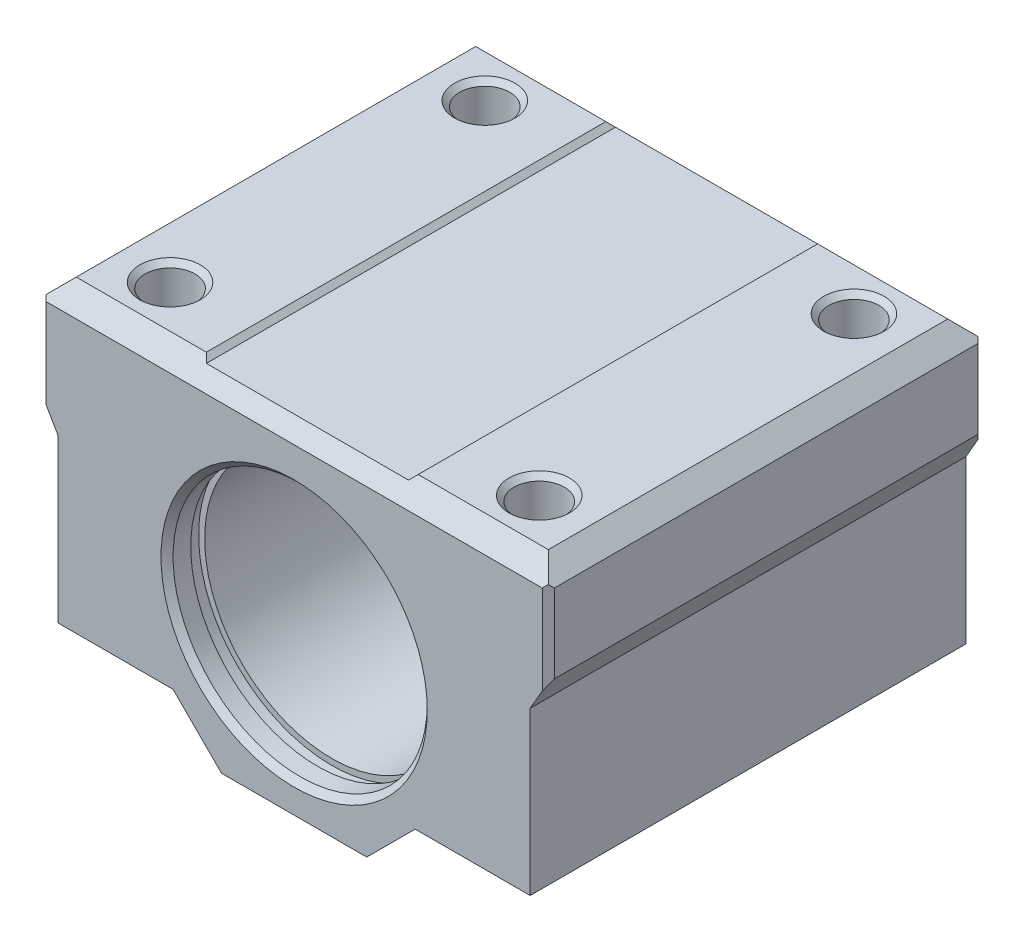
from build123d import *

# Parameters (mm, degrees)
BOSS_EXTRUDE1_DEPTH     = 36
CUT_EXTRUDE1_DEPTH      = 21
CUT_EXTRUDE1_DEPTH_BACK = 21
SKETCH2_W               = 54
SKETCH2_H               = 56
CUT_EXTRUDE2_DEPTH      = 28
CUT_EXTRUDE2_DEPTH_BACK = 28
SKETCH4_W               = 52
SKETCH4_H               = 46


with BuildPart() as part:
    # Sketch1 → Boss-Extrude1 (new body)
    with BuildSketch(Plane.XY):
        Polygon((-21, 13.5), (-21, 7), (-19.5, 4.401923789), (-19.5, -9), (-10, -9), (-6, -13), (6, -13), (10, -9), (19.5, -9), (19.5, 4.401923789), (21, 7), (21, 13.5), (19.5, 15), (8.75, 15), (8.35, 14.6), (-8.35, 14.6), (-8.75, 15), (-19.5, 15), align=None)
    extrude(amount=BOSS_EXTRUDE1_DEPTH)

    # Sketch2 → Cut-Extrude1 (cut, two sides: drawn at the far end of the back side and taken through both)
    with BuildSketch(Plane(origin=(0, 0, 0), x_dir=(0, 0, -1), z_dir=(1, 0, 0)).offset(-CUT_EXTRUDE1_DEPTH_BACK)):
        with Locations((-18, 0)):
            Rectangle(SKETCH2_W, SKETCH2_H)
        Polygon((-36, 13.5), (-36, -13), (0, -13), (0, 13.5), (-1.5, 15), (-34.5, 15), align=None, mode=Mode.SUBTRACT)
    extrude(amount=CUT_EXTRUDE1_DEPTH + CUT_EXTRUDE1_DEPTH_BACK, mode=Mode.SUBTRACT)

    # Sketch3 → Cut-Revolve1 (revolve, cut)
    with BuildSketch(Plane(origin=(0, 0, 0), x_dir=(0, 0, -1), z_dir=(1, 0, 0)), mode=Mode.PRIVATE) as cut_revolve1_sk:
        Polygon((-36, 0), (-36, 11), (-35.5, 10.5), (-34.04, 10.5), (-34.04, 11), (-32.89, 11), (-32.89, 10.5), (-3.11, 10.5), (-3.11, 11), (-1.96, 11), (-1.96, 10.5), (-0.5, 10.5), (0, 11), (0, 0), align=None)
    revolve(cut_revolve1_sk.sketch.rotate(Axis((0, 0, 0), (0, 0, 1)), 270), axis=Axis((0, 0, 0), (0, 0, 1)), mode=Mode.SUBTRACT)

    # Sketch4 → Cut-Extrude2 (cut, two sides: drawn at the far end of the back side and taken through both)
    with BuildSketch(Plane(origin=(0, 0, 0), x_dir=(1, 0, 0), z_dir=(0, 1, 0)).offset(-CUT_EXTRUDE2_DEPTH_BACK)):
        with Locations((0, -18)):
            Rectangle(SKETCH4_W, SKETCH4_H)
        Polygon((-21, -0.5), (-21, -35.5), (-20.5, -36), (20.5, -36), (21, -35.5), (21, -0.5), (20.5, 0), (-20.5, 0), align=None, mode=Mode.SUBTRACT)
    extrude(amount=CUT_EXTRUDE2_DEPTH + CUT_EXTRUDE2_DEPTH_BACK, mode=Mode.SUBTRACT)

    # Sketch5 → Cut-Revolve2 (revolve, cut)
    with BuildSketch(Plane(origin=(15.25, 0, 0), x_dir=(0, 0, -1), z_dir=(1, 0, 0)), mode=Mode.PRIVATE) as cut_revolve2_sk:
        Polygon((-5, 15), (-2.5, 15), (-2.933, 14.567), (-2.933, 1), (-2.85, 1), (-2.85, -8.6), (-2.619059892, -9), (-5, -9), align=None)
    revolve(cut_revolve2_sk.sketch.rotate(Axis((15.25, -9, 5), (0, 1, 0)), 180), axis=Axis((15.25, -9, 5), (0, 1, 0)), mode=Mode.SUBTRACT)

    # Sketch6 → Cut-Revolve3 (revolve, cut)
    with BuildSketch(Plane(origin=(15.25, 0, 0), x_dir=(0, 0, -1), z_dir=(1, 0, 0)), mode=Mode.PRIVATE) as cut_revolve3_sk:
        Polygon((-31, 15), (-28.5, 15), (-28.933, 14.567), (-28.933, 1), (-28.85, 1), (-28.85, -8.6), (-28.619059892, -9), (-31, -9), align=None)
    revolve(cut_revolve3_sk.sketch.rotate(Axis((15.25, -9, 31), (0, 1, 0)), 180), axis=Axis((15.25, -9, 31), (0, 1, 0)), mode=Mode.SUBTRACT)

    # Sketch7 → Cut-Revolve4 (revolve, cut)
    with BuildSketch(Plane(origin=(-15.25, 0, 0), x_dir=(0, 0, -1), z_dir=(1, 0, 0)), mode=Mode.PRIVATE) as cut_revolve4_sk:
        Polygon((-5, 15), (-2.5, 15), (-2.933, 14.567), (-2.933, 1), (-2.85, 1), (-2.85, -8.6), (-2.619059892, -9), (-5, -9), align=None)
    revolve(cut_revolve4_sk.sketch.rotate(Axis((-15.25, -9, 5), (0, 1, 0)), 180), axis=Axis((-15.25, -9, 5), (0, 1, 0)), mode=Mode.SUBTRACT)

    # Sketch8 → Cut-Revolve5 (revolve, cut)
    with BuildSketch(Plane(origin=(-15.25, 0, 0), x_dir=(0, 0, -1), z_dir=(1, 0, 0)), mode=Mode.PRIVATE) as cut_revolve5_sk:
        Polygon((-31, 15), (-28.5, 15), (-28.933, 14.567), (-28.933, 1), (-28.85, 1), (-28.85, -8.6), (-28.619059892, -9), (-31, -9), align=None)
    revolve(cut_revolve5_sk.sketch.rotate(Axis((-15.25, -9, 31), (0, 1, 0)), 180), axis=Axis((-15.25, -9, 31), (0, 1, 0)), mode=Mode.SUBTRACT)


solid = part.part
